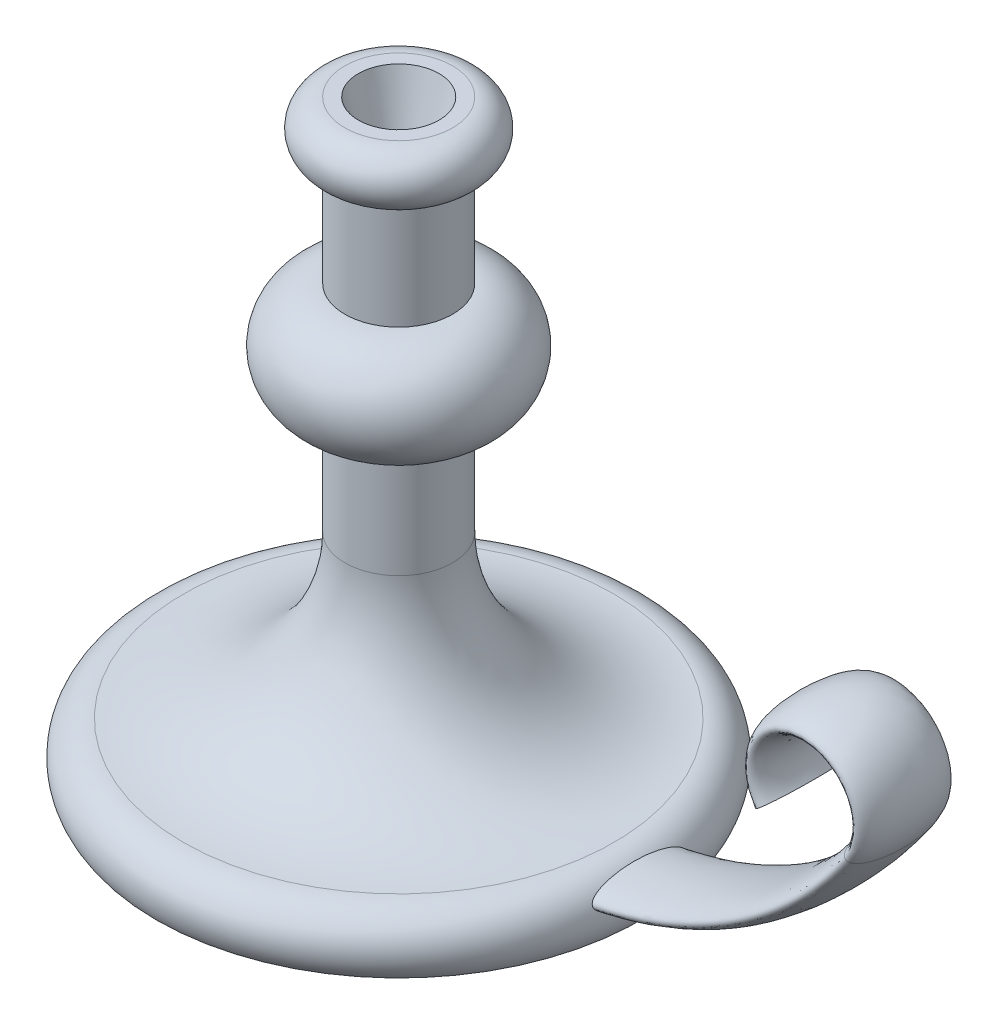
from build123d import *

# Parameters (mm, degrees)
SKETCH3_RX         = 17.5
SKETCH3_RY         = 5
SKETCH7_R          = 15
CUT_EXTRUDE1_DEPTH = 25
CUT_EXTRUDE1_DRAFT = -15


with BuildPart() as part:
    # Sketch1 → Revolve1 (revolve)
    with BuildSketch(Plane.XY, mode=Mode.PRIVATE) as revolve1_sk:
        with BuildLine():
            Line((0, 0), (0, 220))
            Line((0, 220), (20, 220))
            ThreePointArc((20, 220), (30, 210), (20, 200))
            Line((20, 200), (20, 160))
            ThreePointArc((20, 160), (40, 140), (20, 120))
            Line((20, 120), (20, 80))
            ThreePointArc((20, 80), (37.573593129, 37.573593129), (80, 20))
            ThreePointArc((80, 20), (91.180339887, 13.090169944), (90, 0))
            Line((90, 0), (0, 0))
        make_face()
    revolve(revolve1_sk.sketch.rotate(Axis((0, 0, 0), (0, 1, 0)), 90), axis=Axis((0, 0, 0), (0, 1, 0)))

    # Sweep3: sweep along a path in Sketch2
    with BuildLine(Plane.XY) as sweep3_path:
        Line((0, 10), (60, 10))
        ThreePointArc((60, 10), (129.821200219, 27.240819526), (183.592070943, 75))
        ThreePointArc((183.592070943, 75), (167.113128151, 106.333333333), (150.634185358, 75))
    # Sketch3 → Sweep3 (sweep)
    with BuildSketch(Plane(origin=(0, 0, 0), x_dir=(0, 0, -1), z_dir=(1, 0, 0))):
        with Locations((0, 10)):
            Ellipse(SKETCH3_RX, SKETCH3_RY)
    sweep(path=sweep3_path.line)


with BuildPart() as cut_extrude1_tool:
    # Sketch7 → Cut-Extrude1 (with draft: the straight prism first)
    with BuildSketch(Plane(origin=(0, 220, 0), x_dir=(1, 0, 0), z_dir=(0, 1, 0))):
        Circle(SKETCH7_R)
    extrude(amount=-CUT_EXTRUDE1_DEPTH)
    # Cut-Extrude1: the draft: its side faces are tilted about the plane it starts from
    cut_extrude1_sides = [cut_extrude1_tool.faces().sort_by_distance(p)[0] for p in [
        (-15, 207.5, 0),
    ]]
    draft(cut_extrude1_sides, Plane(origin=(0, 220, 0), x_dir=(1, 0, 0), z_dir=(0, 1, 0)), CUT_EXTRUDE1_DRAFT)


with BuildPart() as part_1:
    add(part.part)

    # Cut-Extrude1: cut by cut_extrude1_tool
    add(cut_extrude1_tool.part, mode=Mode.SUBTRACT)


solid = part_1.part
